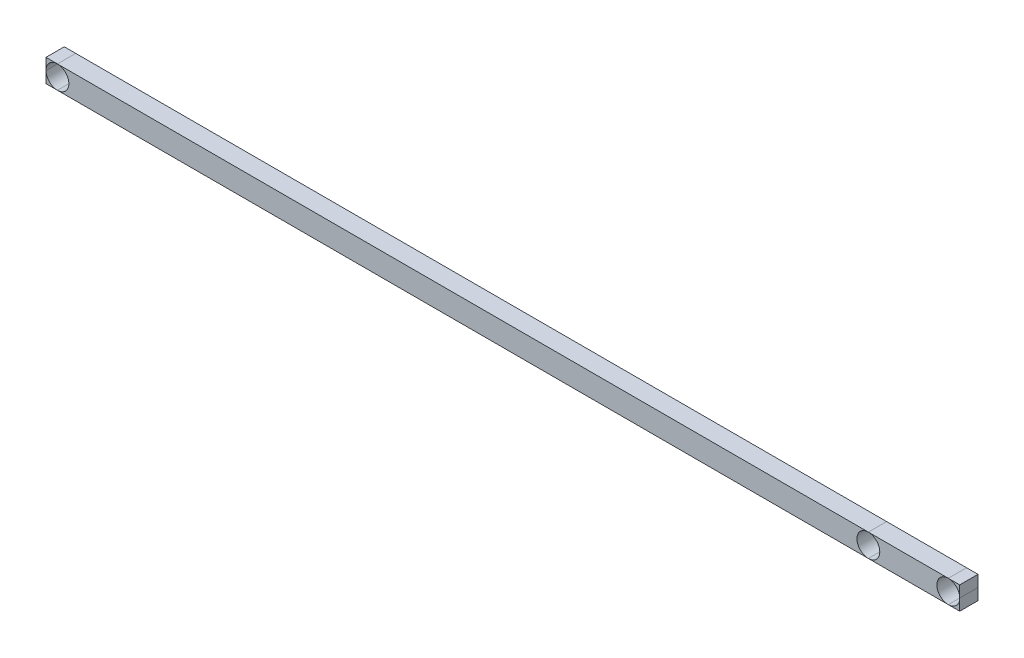
from build123d import *

# Parameters (mm, degrees)
SKETCH1_W           = 200
SKETCH1_H           = 5
BOSS_EXTRUDE1_DEPTH = 4
SKETCH2_R           = 2.5
CUT_EXTRUDE1_DEPTH  = 10


with BuildPart() as part:
    # Sketch1 → Boss-Extrude1 (new body)
    with BuildSketch(Plane.XY):
        with Locations((100, -2.5)):
            Rectangle(SKETCH1_W, SKETCH1_H)
    extrude(amount=BOSS_EXTRUDE1_DEPTH)

    # Sketch2 → Cut-Extrude1 (cut)
    with BuildSketch(Plane.XY.offset(4)):
        with Locations((180, -2.5)):
            Circle(SKETCH2_R)
        with Locations((2.5, -2.5)):
            Circle(SKETCH2_R)
        with Locations((197.5, -2.5)):
            Circle(SKETCH2_R)
    extrude(amount=-CUT_EXTRUDE1_DEPTH, mode=Mode.SUBTRACT)


solid = part.part
